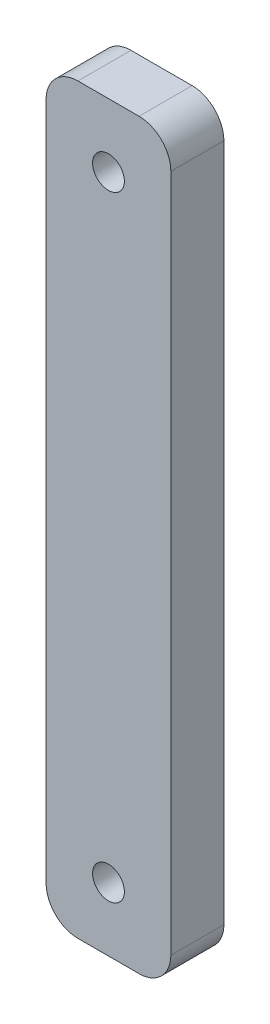
from build123d import *

# Parameters (mm, degrees)
SKETCH1_R           = 1.5
BOSS_EXTRUDE1_DEPTH = 5


with BuildPart() as part:
    # Sketch1 → Boss-Extrude1 (new body)
    with BuildSketch(Plane.XY):
        with BuildLine():
            Line((2.88, -35), (-2.88, -35))
            ThreePointArc((-2.88, -35), (-5.001320344, -34.121320344), (-5.88, -32))
            Line((-5.88, -32), (-5.88, 32))
            ThreePointArc((-5.88, 32), (-5.001320344, 34.121320344), (-2.88, 35))
            Line((-2.88, 35), (2.88, 35))
            ThreePointArc((2.88, 35), (5.001320344, 34.121320344), (5.88, 32))
            Line((5.88, 32), (5.88, -32))
            ThreePointArc((5.88, -32), (5.001320344, -34.121320344), (2.88, -35))
        make_face()
        with Locations((0, -29)):
            Circle(SKETCH1_R, mode=Mode.SUBTRACT)
        with Locations((0, 29)):
            Circle(SKETCH1_R, mode=Mode.SUBTRACT)
    extrude(amount=BOSS_EXTRUDE1_DEPTH)


solid = part.part
